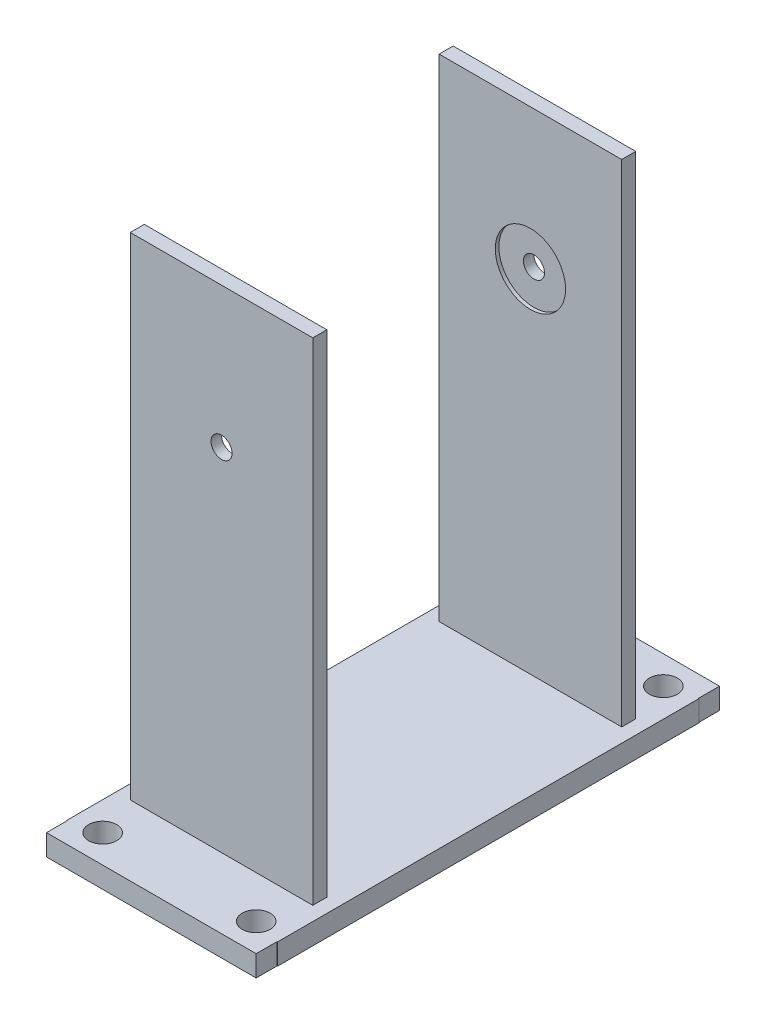
from build123d import *

# Parameters (mm, degrees)
SKETCH_1_W               = 30
SKETCH_1_H               = 60
EXTRUDE_1_DEPTH          = 3
SKETCH_2_W               = 26
SKETCH_2_H               = 2
EXTRUDE_3_DEPTH          = 70
SKETCH_4_R               = 5
CUT_EXTRUDE_2_DEPTH      = 21.5
CUT_EXTRUDE_3_DEPTH      = 91.58835466
CUT_EXTRUDE_3_DEPTH_BACK = 91.58835466
SKETCH_5_R               = 1.5
SKETCH_7_W               = 29.85954739
SKETCH_7_H               = 3
EXTRUDE_4_DEPTH          = 3
CUT_EXTRUDE_5_DEPTH      = 82.504601097
CUT_EXTRUDE_5_DEPTH_BACK = 82.504601097
SKETCH_8_R               = 2


with BuildPart() as part:
    # 草图1 → 凸台-拉伸1 (new body)
    with BuildSketch(Plane(origin=(0, 0, 0), x_dir=(1, 0, 0), z_dir=(0, 1, 0))):
        Rectangle(SKETCH_1_W, SKETCH_1_H)
    extrude(amount=EXTRUDE_1_DEPTH)

    # 草图2 → 凸台-拉伸3 (add)
    with BuildSketch(Plane(origin=(0, 3, 0), x_dir=(1, 0, 0), z_dir=(0, 1, 0))):
        with Locations((0, 22)):
            Rectangle(SKETCH_2_W, SKETCH_2_H)
        with Locations((0, -22)):
            Rectangle(SKETCH_2_W, SKETCH_2_H)
    extrude(amount=EXTRUDE_3_DEPTH)

    # 草图4 → 切除-拉伸2 (cut, symmetric)
    with BuildSketch(Plane.XY):
        with Locations((0, 53)):
            Circle(SKETCH_4_R)
    extrude(amount=CUT_EXTRUDE_2_DEPTH, both=True, mode=Mode.SUBTRACT)

    # 草图5 → 切除-拉伸3 (cut, two sides: drawn at the far end of the back side and taken through both)
    with BuildSketch(Plane.XY.offset(-21.5).offset(-CUT_EXTRUDE_3_DEPTH_BACK)):
        with Locations((0, 53)):
            Circle(SKETCH_5_R)
    extrude(amount=CUT_EXTRUDE_3_DEPTH + CUT_EXTRUDE_3_DEPTH_BACK, mode=Mode.SUBTRACT)

    # 草图7 → 凸台-拉伸4 (add)
    with BuildSketch(Plane.XZ):
        Polygon((-14.929773695, 33), (-14.929773695, 30), (-12, 30), (14.929773695, 30), (14.929773695, 33), align=None)
        with Locations((0, -31.5)):
            Rectangle(SKETCH_7_W, SKETCH_7_H)
    extrude(amount=-EXTRUDE_4_DEPTH)

    # 草图8 → 切除-拉伸5 (cut, two sides: drawn at the far end of the back side and taken through both)
    with BuildSketch(Plane.XZ.offset(-CUT_EXTRUDE_5_DEPTH_BACK)):
        with BuildLine():
            ThreePointArc((-8.929773695, 29), (-9.515560133, 30.414213562), (-10.929773695, 31))
            Line((-10.929773695, 31), (-10.929773695, 29))
            Line((-10.929773695, 29), (-12.929773695, 29))
            ThreePointArc((-12.929773695, 29), (-10.929773695, 27), (-8.929773695, 29))
        make_face()
        with BuildLine():
            Line((-10.929773695, 29), (-10.929773695, 31))
            ThreePointArc((-10.929773695, 31), (-12.343987258, 30.414213562), (-12.929773695, 29))
            Line((-12.929773695, 29), (-10.929773695, 29))
        make_face()
        with Locations(Location((10.929773695, 29, 0), (0, 0, 270))):
            Circle(SKETCH_8_R)
        with Locations(Location((-10.929773695, -29, 0), (0, 0, 270))):
            Circle(SKETCH_8_R)
        with Locations(Location((10.929773695, -29, 0), (0, 0, 270))):
            Circle(SKETCH_8_R)
    extrude(amount=CUT_EXTRUDE_5_DEPTH + CUT_EXTRUDE_5_DEPTH_BACK, mode=Mode.SUBTRACT)


solid = part.part
